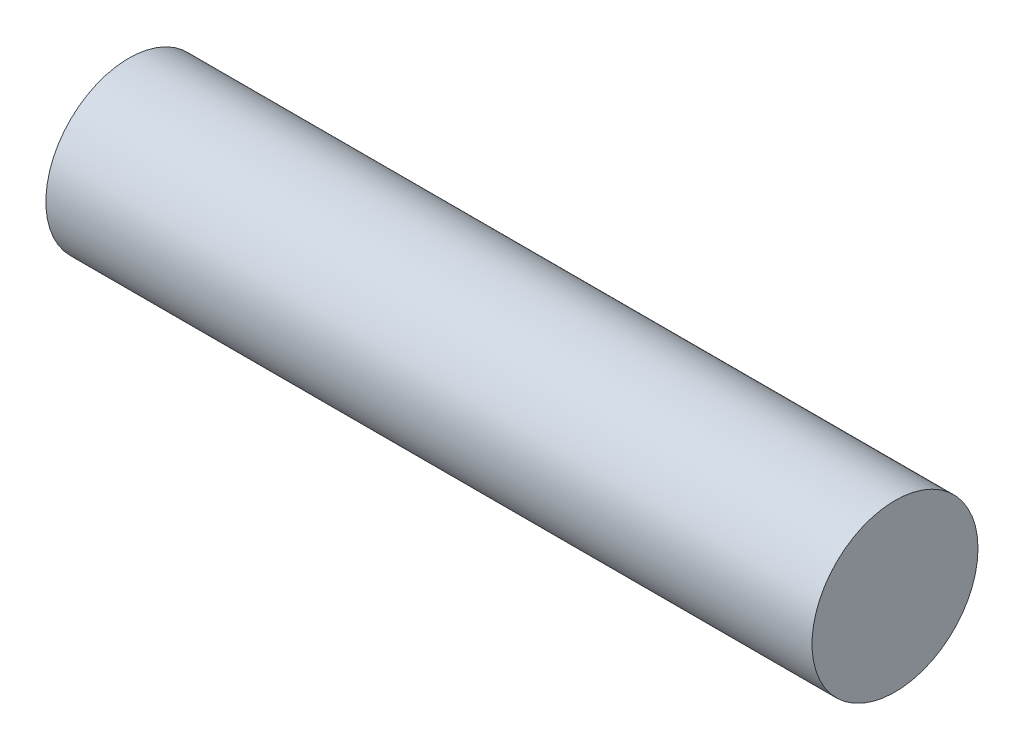
from build123d import *

# Parameters (mm, degrees)
SKETCH2_R           = 1.083065324
BOSS_EXTRUDE1_DEPTH = 10


with BuildPart() as part:
    # Sketch2 → Boss-Extrude1 (new body)
    with BuildSketch(Plane(origin=(0, 0, 0), x_dir=(0, 0, -1), z_dir=(1, 0, 0))):
        with Locations((7.152070217, 13.585377771)):
            Circle(SKETCH2_R)
    extrude(amount=BOSS_EXTRUDE1_DEPTH)


solid = part.part
